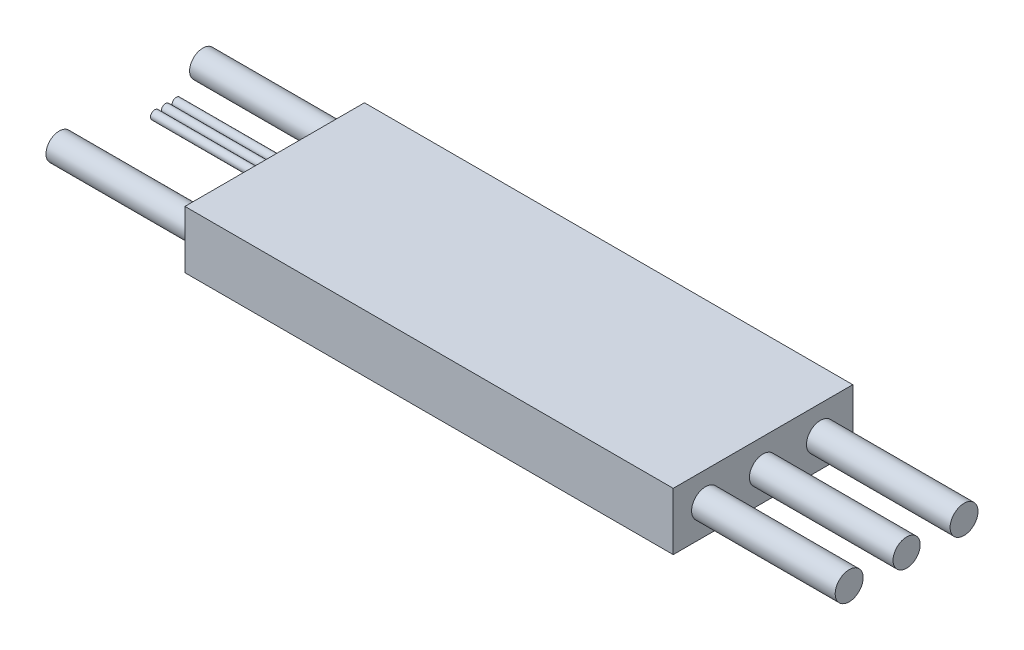
from build123d import *

# Parameters (mm, degrees)
ESQUISSE1_W        = 68
ESQUISSE1_H        = 25
BOSS_EXTRU_1_DEPTH = 8
ESQUISSE2_R        = 1.85
ESQUISSE2_R_2      = 0.6
BOSS_EXTRU_2_DEPTH = 20
ESQUISSE3_R        = 1.945702626
ESQUISSE3_R_2      = 1.891437126
BOSS_EXTRU_3_DEPTH = 20


with BuildPart() as part:
    # Esquisse1 → Boss.-Extru.1 (new body)
    with BuildSketch(Plane(origin=(0, 0, 0), x_dir=(1, 0, 0), z_dir=(0, 1, 0))):
        Rectangle(ESQUISSE1_W, ESQUISSE1_H)
    extrude(amount=BOSS_EXTRU_1_DEPTH)

    # Esquisse2 → Boss.-Extru.2 (add)
    with BuildSketch(Plane.ZY.offset(34)):
        with Locations(Location((-10, 4, 0), (0, 0, 180))):
            Circle(ESQUISSE2_R)
        with Locations(Location((10, 4, 0), (0, 0, 180))):
            Circle(ESQUISSE2_R)
        with Locations(Location((-6.30252834, 1.162523301, 0), (0, 0, 180))):
            Circle(ESQUISSE2_R_2)
        with Locations(Location((-4.80252834, 1.162523301, 0), (0, 0, 180))):
            Circle(ESQUISSE2_R_2)
        with Locations(Location((-3.30252834, 1.162523301, 0), (0, 0, 180))):
            Circle(ESQUISSE2_R_2)
    extrude(amount=BOSS_EXTRU_2_DEPTH)

    # Esquisse3 → Boss.-Extru.3 (add)
    with BuildSketch(Plane(origin=(34, 0, 0), x_dir=(0, 0, -1), z_dir=(1, 0, 0))):
        with Locations(Location((-8, 4, 0), (0, 0, 180))):
            Circle(ESQUISSE3_R)
        with Locations(Location((0, 4, 0), (0, 0, 180))):
            Circle(ESQUISSE3_R_2)
        with Locations(Location((8, 4, 0), (0, 0, 180))):
            Circle(ESQUISSE3_R)
    extrude(amount=BOSS_EXTRU_3_DEPTH)


solid = part.part
